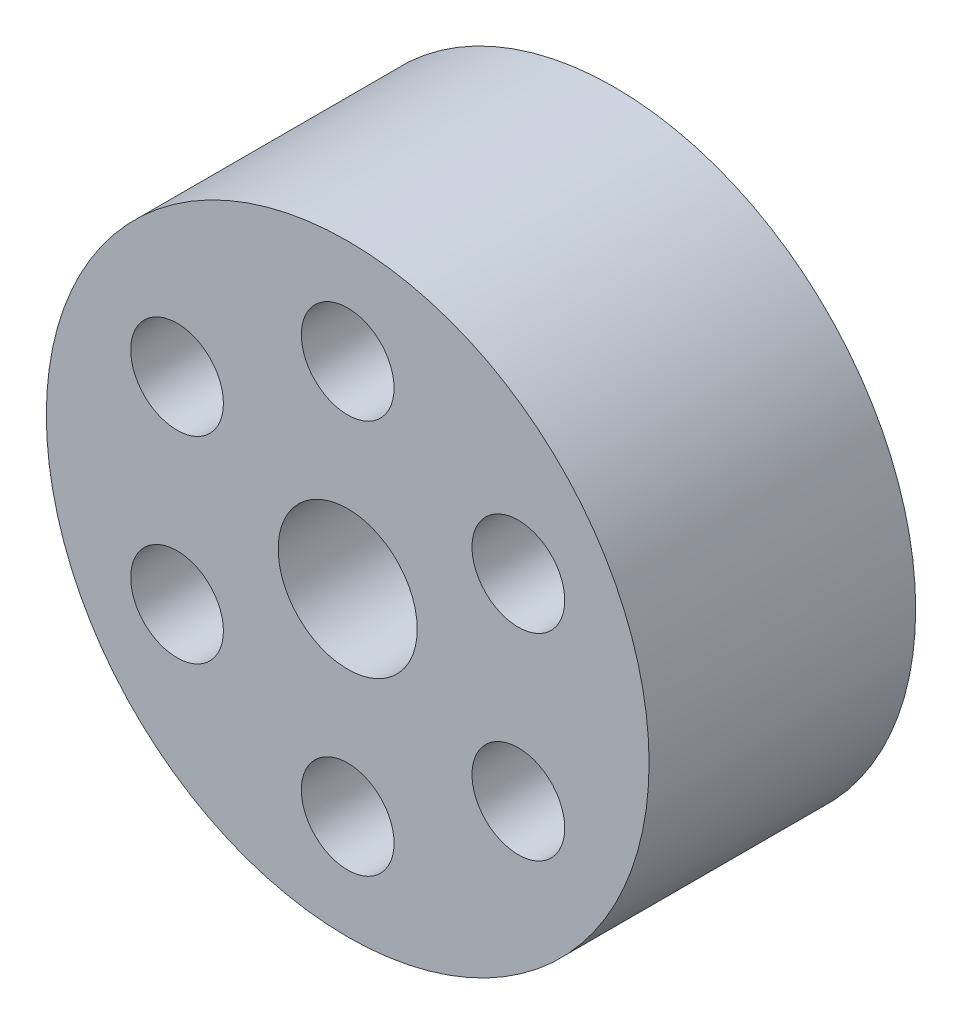
from build123d import *

# Parameters (mm, degrees)
ESQUISSE1_R             = 13
BOSS_EXTRU_1_DEPTH      = 11.5
ESQUISSE2_R             = 2
ENL_V_MAT_EXTRU_1_DEPTH = 5
ESQUISSE3_R             = 3
ENL_V_MAT_EXTRU_2_DEPTH = 4.5


with BuildPart() as part:
    # Esquisse1 → Boss.-Extru.1 (new body)
    with BuildSketch(Plane.XY):
        Circle(ESQUISSE1_R)
    extrude(amount=BOSS_EXTRU_1_DEPTH)

    # Esquisse2 → Enlèv. mat.-Extru.1 (cut)
    with BuildSketch(Plane.XY.offset(11.5)):
        with Locations((0, 8.5)):
            Circle(ESQUISSE2_R)
        with Locations((-7.361215932, 4.25)):
            Circle(ESQUISSE2_R)
        with Locations((-7.361215932, -4.25)):
            Circle(ESQUISSE2_R)
        with Locations((0, -8.5)):
            Circle(ESQUISSE2_R)
        with Locations((7.361215932, -4.25)):
            Circle(ESQUISSE2_R)
        with Locations((7.361215932, 4.25)):
            Circle(ESQUISSE2_R)
    extrude(amount=-ENL_V_MAT_EXTRU_1_DEPTH, mode=Mode.SUBTRACT)

    # Esquisse3 → Enlèv. mat.-Extru.2 (cut)
    with BuildSketch(Plane.XY.offset(11.5)):
        Circle(ESQUISSE3_R)
    extrude(amount=-ENL_V_MAT_EXTRU_2_DEPTH, mode=Mode.SUBTRACT)


solid = part.part
